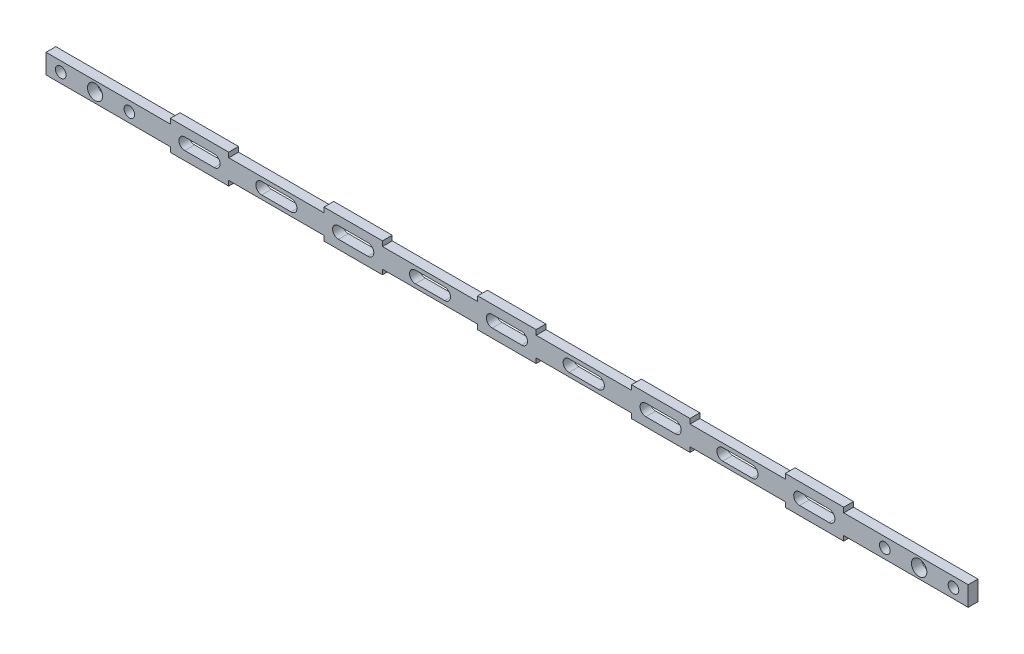
from build123d import *

# Parameters (mm, degrees)
SKETCH1_W           = 596.9
SKETCH1_H           = 12.7
BOSS_EXTRUDE1_DEPTH = 6.35
SKETCH3_W           = 37.846
SKETCH3_H           = 6.35
BOSS_EXTRUDE2_DEPTH = 3.175
SKETCH4_R           = 3.429
SKETCH4_R_2         = 4.8895
CUT_EXTRUDE1_DEPTH  = 299.669467179
SKETCH5_R           = 4.9784
CUT_EXTRUDE2_DEPTH  = 299.669467179
CUT_EXTRUDE3_DEPTH  = 299.669467179


with BuildPart() as part:
    # Sketch1 → Boss-Extrude1 (new body)
    with BuildSketch(Plane.XY):
        Rectangle(SKETCH1_W, SKETCH1_H)
    extrude(amount=BOSS_EXTRUDE1_DEPTH)

    # Sketch3 → Boss-Extrude2 (add)
    with BuildSketch(Plane(origin=(0, 6.35, 0), x_dir=(1, 0, 0), z_dir=(0, 1, 0))):
        with Locations((-199.093666667, -3.175)):
            Rectangle(SKETCH3_W, SKETCH3_H)
        with Locations((-99.610333333, -3.175)):
            Rectangle(SKETCH3_W, SKETCH3_H)
        with Locations((-0.127, -3.175)):
            Rectangle(SKETCH3_W, SKETCH3_H)
        with Locations((99.483333333, -3.175)):
            Rectangle(SKETCH3_W, SKETCH3_H)
        with Locations((198.966666751, -3.175)):
            Rectangle(SKETCH3_W, SKETCH3_H)
    boss_extrude2 = extrude(amount=BOSS_EXTRUDE2_DEPTH)

    # Mirror1: Boss-Extrude2 across plane
    add(boss_extrude2.mirror(Plane.ZX))

    # Sketch4 → Cut-Extrude1 (cut, through all)
    with BuildSketch(Plane(origin=(0, 0, 0), x_dir=(-1, 0, 0), z_dir=(0, 0, -1))):
        with Locations((-288.925, 0)):
            Circle(SKETCH4_R)
        with Locations((-244.475, 0)):
            Circle(SKETCH4_R)
        with Locations((-266.7, 0)):
            Circle(SKETCH4_R_2)
    cut_extrude1 = extrude(amount=-CUT_EXTRUDE1_DEPTH, mode=Mode.SUBTRACT)

    # Mirror2: Cut-Extrude1 across plane
    add(cut_extrude1.mirror(Plane(origin=(0, 0, 0), x_dir=(0, 0, 1), z_dir=(1, 0, 0))), mode=Mode.SUBTRACT)

    # Sketch5 → Cut-Extrude2 (cut, through all)
    with BuildSketch(Plane(origin=(0, 0, 0), x_dir=(-1, 0, 0), z_dir=(0, 0, -1))):
        with Locations((-266.7, 0)):
            Circle(SKETCH5_R)
    extrude(amount=-CUT_EXTRUDE2_DEPTH, mode=Mode.SUBTRACT)

    # Sketch6 → Cut-Extrude3 (cut, through all)
    with BuildSketch(Plane.XY.offset(6.35)):
        with BuildLine():
            Line((-208.618666667, 3.81), (-189.568666667, 3.81))
            ThreePointArc((-189.568666667, 3.81), (-185.758666667, 0), (-189.568666667, -3.81))
            Line((-189.568666667, -3.81), (-208.618666667, -3.81))
            ThreePointArc((-208.618666667, -3.81), (-212.428666667, 0), (-208.618666667, 3.81))
        make_face()
        with BuildLine():
            Line((-109.135333333, 3.81), (-90.085333333, 3.81))
            ThreePointArc((-90.085333333, 3.81), (-86.275333333, 0), (-90.085333333, -3.81))
            Line((-90.085333333, -3.81), (-109.135333333, -3.81))
            ThreePointArc((-109.135333333, -3.81), (-112.945333333, 0), (-109.135333333, 3.81))
        make_face()
        with BuildLine():
            Line((-9.652, 3.81), (9.398, 3.81))
            ThreePointArc((9.398, 3.81), (13.208, 0), (9.398, -3.81))
            Line((9.398, -3.81), (-9.652, -3.81))
            ThreePointArc((-9.652, -3.81), (-13.462, 0), (-9.652, 3.81))
        make_face()
        with BuildLine():
            Line((89.831333333, 3.81), (108.881333333, 3.81))
            ThreePointArc((108.881333333, 3.81), (112.691333333, 0), (108.881333333, -3.81))
            Line((108.881333333, -3.81), (89.831333333, -3.81))
            ThreePointArc((89.831333333, -3.81), (86.021333333, 0), (89.831333333, 3.81))
        make_face()
        with BuildLine():
            Line((189.314666667, 3.81), (208.364666667, 3.81))
            ThreePointArc((208.364666667, 3.81), (212.174666667, 0), (208.364666667, -3.81))
            Line((208.364666667, -3.81), (189.314666667, -3.81))
            ThreePointArc((189.314666667, -3.81), (185.504666667, 0), (189.314666667, 3.81))
        make_face()
        with BuildLine():
            Line((-158.877, 3.81), (-139.827, 3.81))
            ThreePointArc((-139.827, 3.81), (-136.017, 0), (-139.827, -3.81))
            Line((-139.827, -3.81), (-158.877, -3.81))
            ThreePointArc((-158.877, -3.81), (-162.687, 0), (-158.877, 3.81))
        make_face()
        with BuildLine():
            Line((-59.319456458, 3.81), (-40.417876875, 3.81))
            ThreePointArc((-40.417876875, 3.81), (-36.607876875, 0), (-40.417876875, -3.81))
            Line((-40.417876875, -3.81), (-59.319456458, -3.81))
            ThreePointArc((-59.319456458, -3.81), (-63.129456458, 0), (-59.319456458, 3.81))
        make_face()
        with BuildLine():
            Line((40.089666667, 3.81), (59.139666667, 3.81))
            ThreePointArc((59.139666667, 3.81), (62.949666667, 0), (59.139666667, -3.81))
            Line((59.139666667, -3.81), (40.089666667, -3.81))
            ThreePointArc((40.089666667, -3.81), (36.279666667, 0), (40.089666667, 3.81))
        make_face()
        with BuildLine():
            Line((139.573, 3.81), (158.623, 3.81))
            ThreePointArc((158.623, 3.81), (162.433, 0), (158.623, -3.81))
            Line((158.623, -3.81), (139.573, -3.81))
            ThreePointArc((139.573, -3.81), (135.763, 0), (139.573, 3.81))
        make_face()
    extrude(amount=-CUT_EXTRUDE3_DEPTH, mode=Mode.SUBTRACT)


solid = part.part
